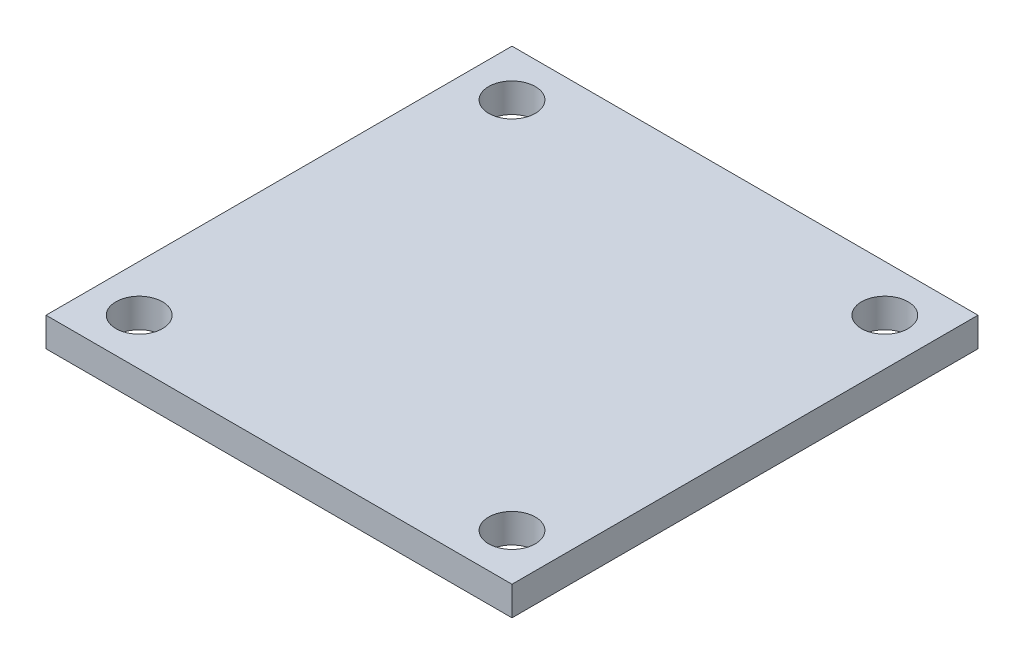
from build123d import *

# Parameters (mm, degrees)
ESBO_O1_W                 = 200
ESBO_O1_H                 = 200
RESSALTO_EXTRUS_O1_DEPTH  = 12.5
ESBO_O2_R                 = 10
CORTE_EXTRUS_O1_DEPTH     = 142.972708645
PADR_O_LINEAR1_COUNT      = 2
PADR_O_LINEAR1_PITCH      = 160
PADR_O_LINEAR1_COUNT_DIR2 = 2
PADR_O_LINEAR1_PITCH_DIR2 = 160


with BuildPart() as part:
    # Esboço1 → Ressalto-extrusão1 (new body)
    with BuildSketch(Plane(origin=(0, 0, 0), x_dir=(1, 0, 0), z_dir=(0, 1, 0))):
        Rectangle(ESBO_O1_W, ESBO_O1_H)
    extrude(amount=RESSALTO_EXTRUS_O1_DEPTH)

    # Esboço2 → Corte-extrusão1 (cut, through all)
    with BuildSketch(Plane(origin=(0, 12.5, 0), x_dir=(1, 0, 0), z_dir=(0, 1, 0))):
        with Locations(Location((-80, 80, 0), (0, 0, 270))):
            Circle(ESBO_O2_R)
    corte_extrus_o1 = extrude(amount=-CORTE_EXTRUS_O1_DEPTH, mode=Mode.SUBTRACT)

    # Padrão linear1: Corte-extrus_o1 2 × 2
    with Locations(*[(i * PADR_O_LINEAR1_PITCH, 0, j * PADR_O_LINEAR1_PITCH_DIR2) for i in range(PADR_O_LINEAR1_COUNT) for j in range(PADR_O_LINEAR1_COUNT_DIR2) if (i, j) != (0, 0)]):
        add(corte_extrus_o1, mode=Mode.SUBTRACT)


solid = part.part
